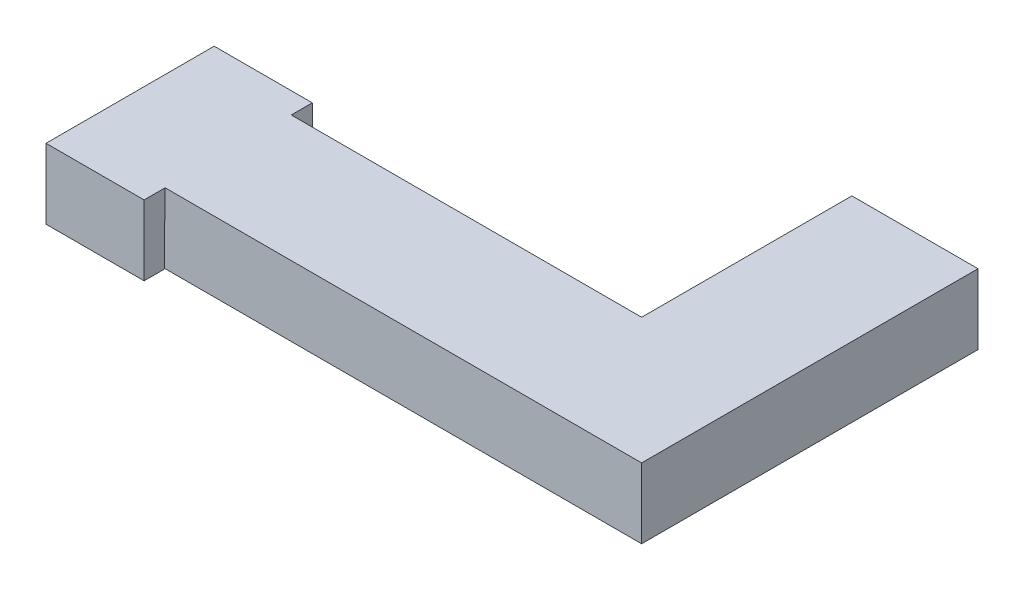
from build123d import *

# Parameters (mm, degrees)
BOSS_EXTRUDE1_DEPTH = 2
SKETCH2_W           = 7
SKETCH2_H           = 1.45
BOSS_EXTRUDE2_DEPTH = 3
SKETCH3_W           = 6.349281592
SKETCH3_H           = 1
BOSS_EXTRUDE3_DEPTH = 2


with BuildPart() as part:
    # Sketch1 → Boss-Extrude1 (new body)
    with BuildSketch(Plane(origin=(0, 0, 0), x_dir=(1, 0, 0), z_dir=(0, 1, 0))):
        Polygon((12.5, -4.5), (21.5, -4.5), (21.5, 19.5), (12.5, 19.5), (12.5, 4.5), (-12.5, 4.5), (-12.5, 6), (-19.5, 6), (-19.5, -6), (-12.5, -6), (-12.5, -4.5), align=None)
    extrude(amount=BOSS_EXTRUDE1_DEPTH)

    # Sketch2 → Boss-Extrude2 (add)
    with BuildSketch(Plane(origin=(0, 0, 0), x_dir=(1, 0, 0), z_dir=(0, 1, 0))):
        Polygon((-13.150718408, 4.5), (12.5, 4.5), (12.5, 19.5), (14, 19.5), (14, 3), (-13.150718408, 3), align=None)
        Polygon((20, 19.5), (20, -3), (-13.150718408, -3), (-13.150718408, -4.5), (21.5, -4.5), (21.5, 19.5), align=None)
        Polygon((-13.150718408, 1), (16, 1), (16, 19.5), (18, 19.5), (18, -1), (-13.150718408, -1), align=None)
        with Locations((-16, 5.275)):
            Rectangle(SKETCH2_W, SKETCH2_H)
        with Locations((-16, -5.275)):
            Rectangle(SKETCH2_W, SKETCH2_H)
    extrude(amount=-BOSS_EXTRUDE2_DEPTH)

    # Sketch3 → Boss-Extrude3 (add)
    with BuildSketch(Plane.XZ.offset(3)):
        with Locations((-16.325359204, 4.05)):
            Rectangle(SKETCH3_W, SKETCH3_H)
        with Locations((-16.325359204, -4.05)):
            Rectangle(SKETCH3_W, SKETCH3_H)
    extrude(amount=-BOSS_EXTRUDE3_DEPTH)


solid = part.part
